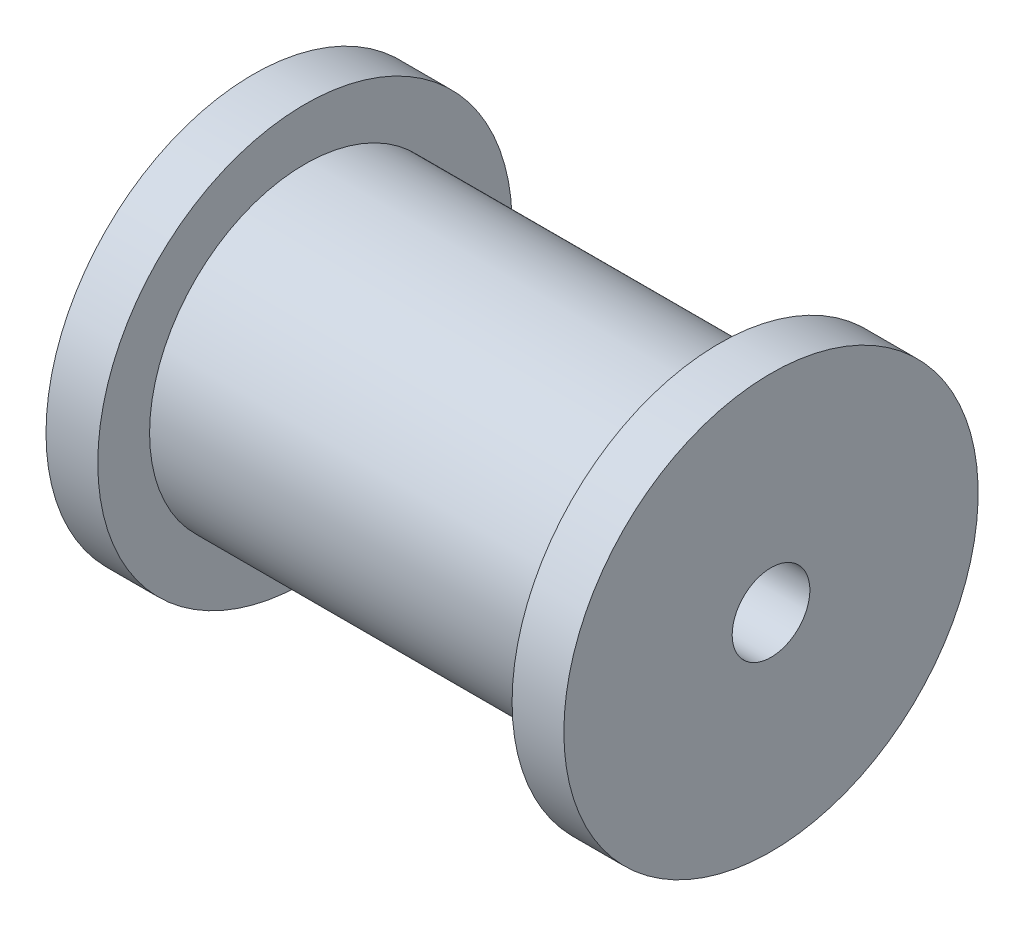
from build123d import *

# Parameters (mm, degrees)
SKETCH1_R           = 25.4
BOSS_EXTRUDE1_DEPTH = 6.35
SKETCH2_R           = 19.05
BOSS_EXTRUDE2_DEPTH = 50.8
SKETCH3_R           = 25.4
BOSS_EXTRUDE3_DEPTH = 6.35
SKETCH4_R           = 4.7625
CUT_EXTRUDE1_DEPTH  = 73.955945611


with BuildPart() as part:
    # Sketch1 → Boss-Extrude1 (new body)
    with BuildSketch(Plane(origin=(0, 0, 0), x_dir=(0, 0, -1), z_dir=(1, 0, 0))):
        Circle(SKETCH1_R)
    extrude(amount=BOSS_EXTRUDE1_DEPTH)

    # Sketch2 → Boss-Extrude2 (add)
    with BuildSketch(Plane(origin=(6.35, 0, 0), x_dir=(0, 0, -1), z_dir=(1, 0, 0))):
        Circle(SKETCH2_R)
    extrude(amount=BOSS_EXTRUDE2_DEPTH)

    # Sketch3 → Boss-Extrude3 (add)
    with BuildSketch(Plane(origin=(57.15, 0, 0), x_dir=(0, 0, -1), z_dir=(1, 0, 0))):
        Circle(SKETCH3_R)
    extrude(amount=BOSS_EXTRUDE3_DEPTH)

    # Sketch4 → Cut-Extrude1 (cut, through all)
    with BuildSketch(Plane(origin=(63.5, 0, 0), x_dir=(0, 0, -1), z_dir=(1, 0, 0))):
        Circle(SKETCH4_R)
    extrude(amount=-CUT_EXTRUDE1_DEPTH, mode=Mode.SUBTRACT)


solid = part.part
